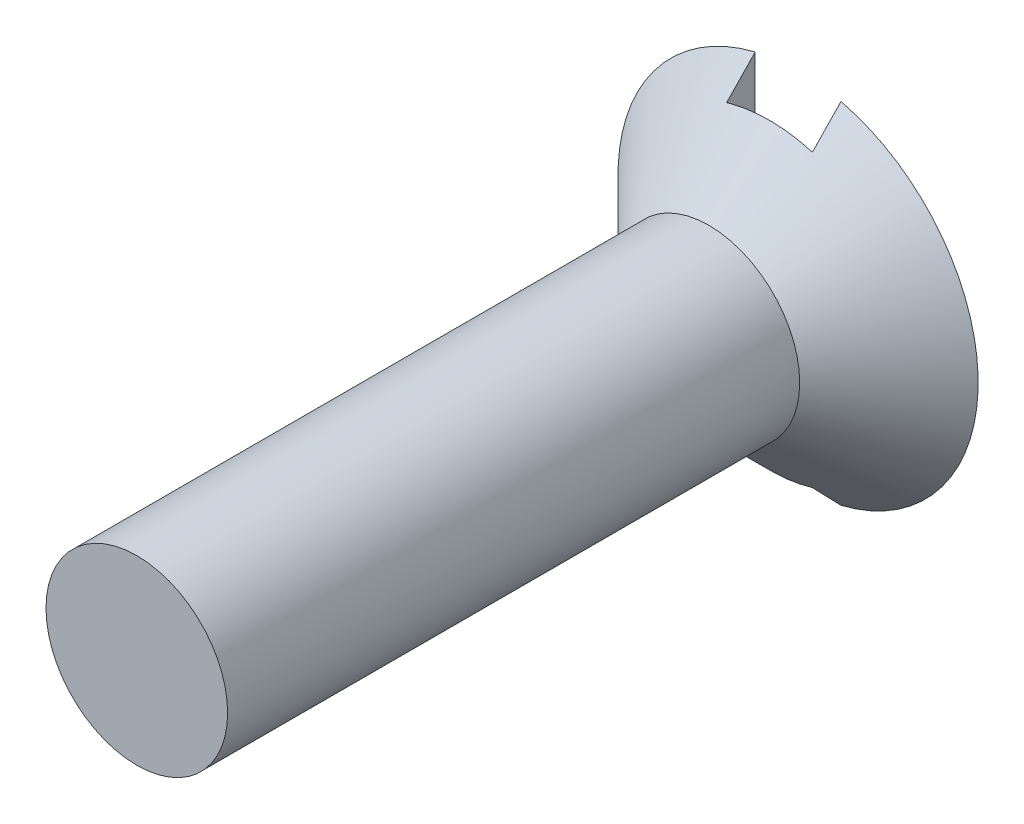
from build123d import *

# Parameters (mm, degrees)
ESBO_O2_W             = 1.5
ESBO_O2_H             = 7
CORTE_EXTRUS_O1_DEPTH = 0.5


with BuildPart() as part:
    # Esboço1 → Revolução1 (revolve)
    with BuildSketch(Plane(origin=(0, 0, 0), x_dir=(0, 0, -1), z_dir=(1, 0, 0)), mode=Mode.PRIVATE) as revolu_o1_sk:
        Polygon((0, 0), (0, 3.1475), (-1.56, 1.5875), (-11.56, 1.5875), (-11.56, 0), align=None)
    revolve(revolu_o1_sk.sketch.rotate(Axis((0, 0, 11.56), (0, 0, -1)), 180), axis=Axis((0, 0, 11.56), (0, 0, -1)))

    # Esboço2 → Corte-extrusão1 (cut)
    with BuildSketch(Plane(origin=(0, 0, 0), x_dir=(-1, 0, 0), z_dir=(0, 0, -1))):
        Rectangle(ESBO_O2_W, ESBO_O2_H)
    extrude(amount=-CORTE_EXTRUS_O1_DEPTH, mode=Mode.SUBTRACT)


solid = part.part
